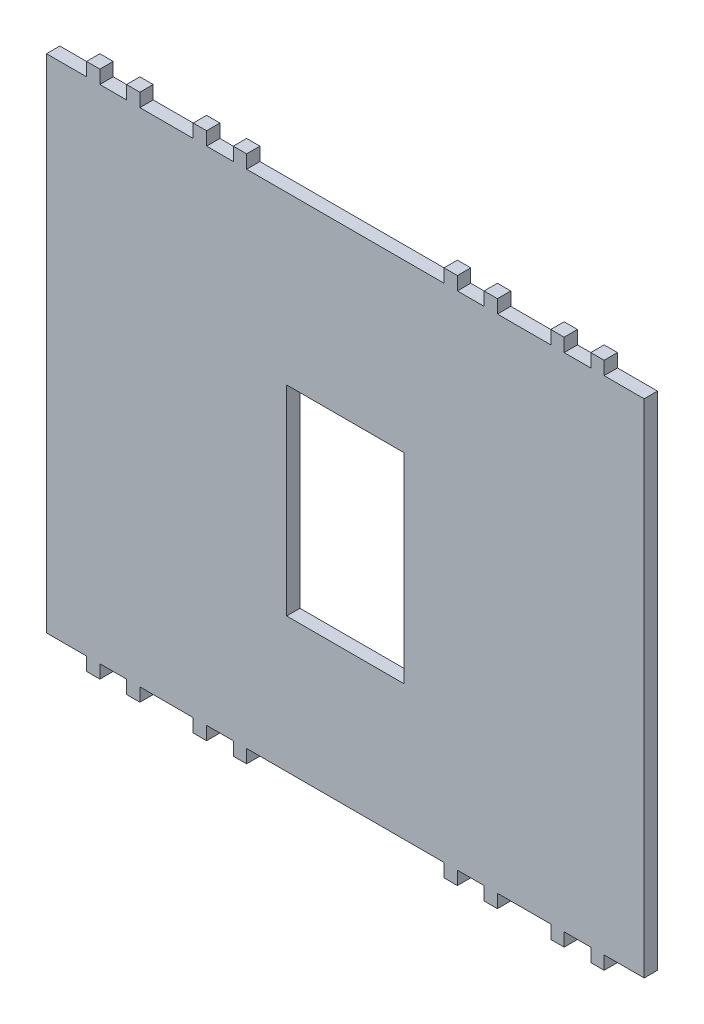
from build123d import *

# Parameters (mm, degrees)
BOSS_EXTRU_1_DEPTH = 5


with BuildPart() as part:
    # Esquisse1 → Boss.-Extru.1 (new body)
    with BuildSketch(Plane.XY):
        Polygon((-30, 188), (-45, 188), (-89, 188), (-104, 188), (-104, 193), (-109, 193), (-109, 188), (-114, 188), (-119, 188), (-119, 193), (-124, 193), (-124, 188), (-144, 188), (-144, 193), (-149, 193), (-149, 188), (-154, 188), (-159, 188), (-159, 193), (-164, 193), (-164, 188), (-179, 188), (-179, 0), (-164, 0), (-164, -5), (-159, -5), (-159, 0), (-154, 0), (-149, 0), (-149, -5), (-144, -5), (-144, 0), (-124, 0), (-124, -5), (-119, -5), (-119, 0), (-114, 0), (-109, 0), (-109, -5), (-104, -5), (-104, 0), (-89, 0), (-45, 0), (-30, 0), (-30, -5), (-25, -5), (-25, 0), (-20, 0), (-15, 0), (-15, -5), (-10, -5), (-10, 0), (10, 0), (10, -5), (15, -5), (15, 0), (20, 0), (25, 0), (25, -5), (30, -5), (30, 0), (45, 0), (45, 188), (30, 188), (30, 193), (25, 193), (25, 188), (20, 188), (15, 188), (15, 193), (10, 193), (10, 188), (-10, 188), (-10, 193), (-15, 193), (-15, 188), (-20, 188), (-25, 188), (-25, 193), (-30, 193), align=None)
        Polygon((-45, 125.5), (-89, 125.5), (-89, 50.5), (-67, 50.5), (-45, 50.5), align=None, mode=Mode.SUBTRACT)
    extrude(amount=BOSS_EXTRU_1_DEPTH)


solid = part.part
